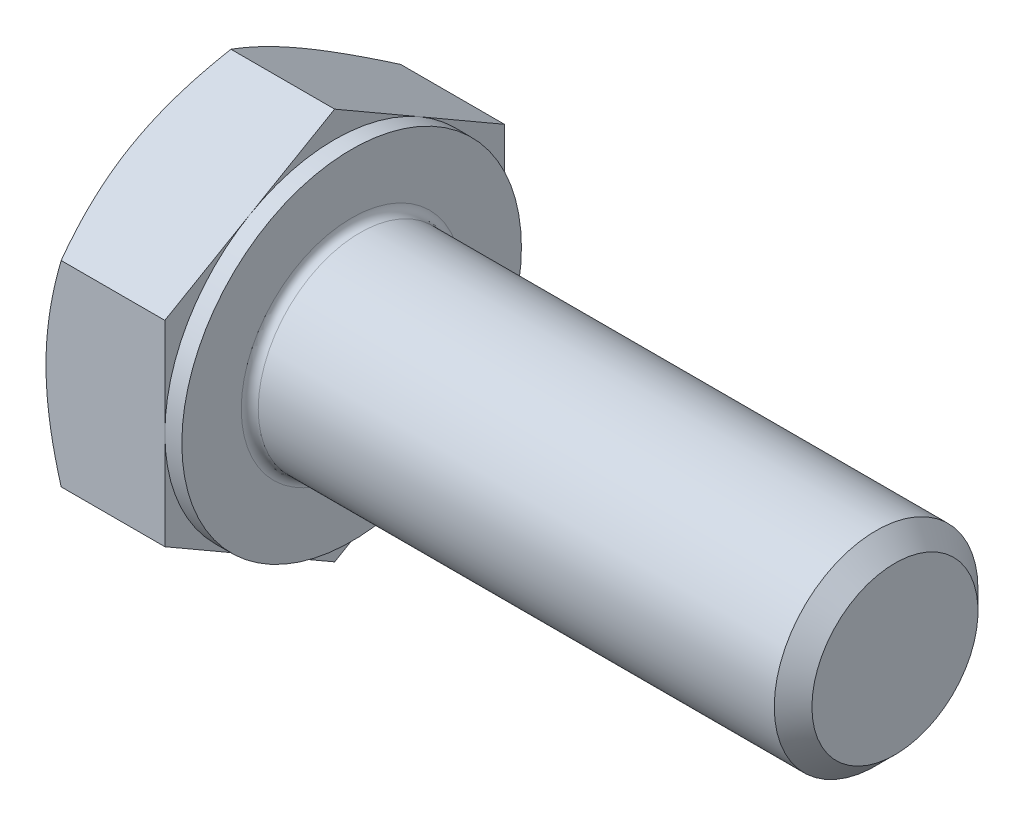
from build123d import *

# Parameters (mm, degrees)
BASEHEAD_DEPTH = 4
SKETCH4_W      = 0.5
SKETCH4_H      = 10.773502692
HEADFILLET_R   = 0.25


with BuildPart() as part:
    # Sketch1 → BaseHead (new body)
    with BuildSketch(Plane(origin=(0, 0, 0), x_dir=(0, 0, -1), z_dir=(1, 0, 0))):
        Polygon((5, 2.886751346), (5, -2.886751346), (0, -5.773502692), (-5, -2.886751346), (-5, 2.886751346), (0, 5.773502692), align=None)
    extrude(amount=BASEHEAD_DEPTH)

    # BodySke → BaseBody (revolve)
    with BuildSketch(Plane.XY, mode=Mode.PRIVATE) as basebody_sk:
        Polygon((0, 0), (20, 0), (20, 2.4455), (19.4455, 3), (0, 3), align=None)
    revolve(basebody_sk.sketch.rotate(Axis((0, 0, 0), (1, 0, 0)), 90), axis=Axis((0, 0, 0), (1, 0, 0)))

    # Sketch3 → HeadChamfer (revolve, cut)
    with BuildSketch(Plane.XY):
        Polygon((0, 5), (3.333333333, 10.773502692), (3.333333333, 15.773502692), (-10, 15.773502692), (-10, 5), align=None)
    revolve(axis=Axis((0, 0, 0), (1, 0, 0)), mode=Mode.SUBTRACT)

    # Sketch4 → BearingFace (revolve, cut)
    with BuildSketch(Plane.XY, mode=Mode.PRIVATE) as bearingface_sk:
        with Locations((3.75, 10.386751346)):
            Rectangle(SKETCH4_W, SKETCH4_H)
    revolve(bearingface_sk.sketch.rotate(Axis((0, 0, 0), (1, 0, 0)), 270), axis=Axis((0, 0, 0), (1, 0, 0)), mode=Mode.SUBTRACT)

    # HeadFillet
    headfillet_edges = [part.edges().sort_by_distance(p)[0] for p in [
        (4, 0, -3),
    ]]
    fillet(headfillet_edges, radius=HEADFILLET_R)


solid = part.part
